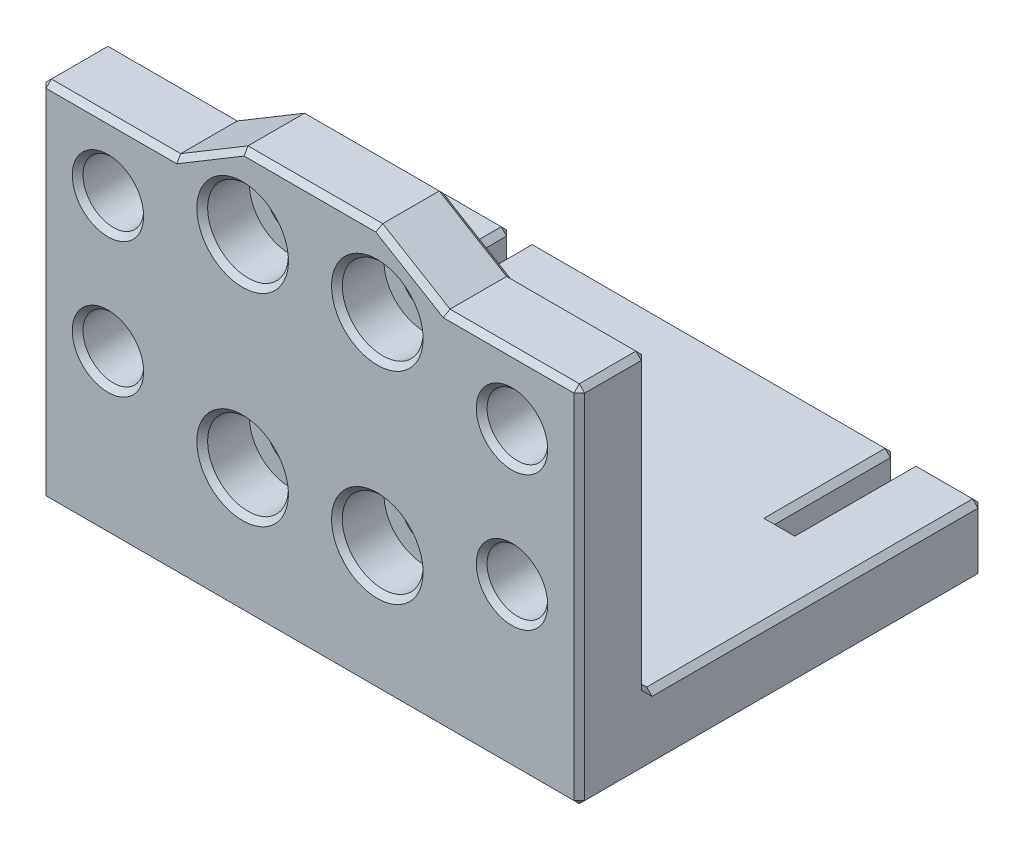
from build123d import *

# Parameters (mm, degrees)
SKETCH1_W           = 40
SKETCH1_H           = 27
BOSS_EXTRUDE1_DEPTH = 5
SKETCH2_W           = 40
SKETCH2_H           = 5
BOSS_EXTRUDE2_DEPTH = 25
SKETCH3_R           = 1.65
CUT_EXTRUDE1_DEPTH  = 15
BOSS_EXTRUDE3_DEPTH = 5
SKETCH5_R           = 3
CUT_EXTRUDE2_DEPTH  = 3.5
SKETCH6_W           = 1.5
SKETCH6_H           = 9
CUT_EXTRUDE3_DEPTH  = 5
SKETCH7_R           = 2.25
CUT_EXTRUDE4_DEPTH  = 5
CHAMFER1_SIZE       = 0.4


with BuildPart() as part:
    # Sketch1 → Boss-Extrude1 (new body)
    with BuildSketch(Plane.XY):
        Rectangle(SKETCH1_W, SKETCH1_H)
    extrude(amount=BOSS_EXTRUDE1_DEPTH)

    # Sketch2 → Boss-Extrude2 (add)
    with BuildSketch(Plane(origin=(0, 0, 0), x_dir=(-1, 0, 0), z_dir=(0, 0, -1))):
        with Locations((0, -11)):
            Rectangle(SKETCH2_W, SKETCH2_H)
    extrude(amount=BOSS_EXTRUDE2_DEPTH)

    # Sketch3 → Cut-Extrude1 (cut)
    with BuildSketch(Plane.XY.offset(5)):
        with Locations((-5, 11)):
            Circle(SKETCH3_R)
        with Locations((5, 11)):
            Circle(SKETCH3_R)
        with Locations((5, -4)):
            Circle(SKETCH3_R)
        with Locations((-5, -4)):
            Circle(SKETCH3_R)
    extrude(amount=-CUT_EXTRUDE1_DEPTH, mode=Mode.SUBTRACT)

    # Sketch4 → Boss-Extrude3 (add)
    with BuildSketch(Plane.XY.offset(5)):
        Polygon((-10, 13.5), (-5, 16.5), (5, 16.5), (10, 13.5), align=None)
    extrude(amount=-BOSS_EXTRUDE3_DEPTH)

    # Sketch5 → Cut-Extrude2 (cut)
    with BuildSketch(Plane.XY.offset(5)):
        with Locations((-5, 11)):
            Circle(SKETCH5_R)
        with Locations((5, 11)):
            Circle(SKETCH5_R)
        with Locations((5, -4)):
            Circle(SKETCH5_R)
        with Locations((-5, -4)):
            Circle(SKETCH5_R)
    extrude(amount=-CUT_EXTRUDE2_DEPTH, mode=Mode.SUBTRACT)

    # Sketch6 → Cut-Extrude3 (cut)
    with BuildSketch(Plane(origin=(0, -8.5, 0), x_dir=(1, 0, 0), z_dir=(0, 1, 0))):
        with Locations((-14.25, 20.5)):
            Rectangle(SKETCH6_W, SKETCH6_H)
        with Locations((14.25, 20.5)):
            Rectangle(SKETCH6_W, SKETCH6_H)
    extrude(amount=-CUT_EXTRUDE3_DEPTH, mode=Mode.SUBTRACT)

    # Sketch7 → Cut-Extrude4 (cut)
    with BuildSketch(Plane.XY.offset(5)):
        with Locations((-15, 8.5)):
            Circle(SKETCH7_R)
        with Locations((15, 8.5)):
            Circle(SKETCH7_R)
        with Locations((15, -1.5)):
            Circle(SKETCH7_R)
        with Locations((-15, -1.5)):
            Circle(SKETCH7_R)
    extrude(amount=-CUT_EXTRUDE4_DEPTH, mode=Mode.SUBTRACT)

    # Chamfer1
    chamfer1_edges = [part.edges().sort_by_distance(p)[0] for p in [
        (-15, -13.5, -20.5),
        (-15, -11, -25),
        (-13.5, -13.5, -20.5),
        (-13.5, -11, -25),
        (-14.25, -13.5, -16),
        (-15, -8.5, -20.5),
        (-14.25, -8.5, -16),
        (-13.5, -8.5, -20.5),
        (13.5, -13.5, -20.5),
        (13.5, -11, -25),
        (15, -13.5, -20.5),
        (15, -11, -25),
        (14.25, -13.5, -16),
        (13.5, -8.5, -20.5),
        (14.25, -8.5, -16),
        (15, -8.5, -20.5),
        (-17.25, -1.5, 0),
        (-17.25, -1.5, 5),
        (-20, 0, 5),
        (12.75, -1.5, 0),
        (12.75, -1.5, 5),
        (12.75, 8.5, 0),
        (12.75, 8.5, 5),
        (-17.25, 8.5, 0),
        (-17.25, 8.5, 5),
        (20, 2.5, 0),
        (20, -8.5, -12.5),
        (0, -8.5, 0),
        (0, -13.5, 5),
        (-20, -8.5, -12.5),
        (20, -11, -25),
        (17.5, -13.5, -25),
        (-20, -11, -25),
        (-17.5, -8.5, -25),
        (-6.65, -4, 0),
        (3.35, -4, 0),
        (3.35, 11, 0),
        (-6.65, 11, 0),
        (-15, 13.5, 0),
        (-15, 13.5, 5),
        (20, 0, 5),
        (-7.5, 15, 0),
        (0, 16.5, 0),
        (7.5, 15, 0),
        (7.5, 15, 5),
        (0, 16.5, 5),
        (-7.5, 15, 5),
        (-20, 2.5, 0),
        (15, 13.5, 0),
        (-8, -4, 5),
        (2, -4, 5),
        (2, 11, 5),
        (-8, 11, 5),
        (20, -13.5, -10),
        (-20, -13.5, -10),
        (-20, 13.5, 2.5),
        (20, 13.5, 2.5),
        (0, -13.5, -25),
        (15, 13.5, 5),
        (-17.5, -13.5, -25),
        (0, -8.5, -25),
        (17.5, -8.5, -25),
    ]]
    chamfer(chamfer1_edges, length=CHAMFER1_SIZE)


solid = part.part
